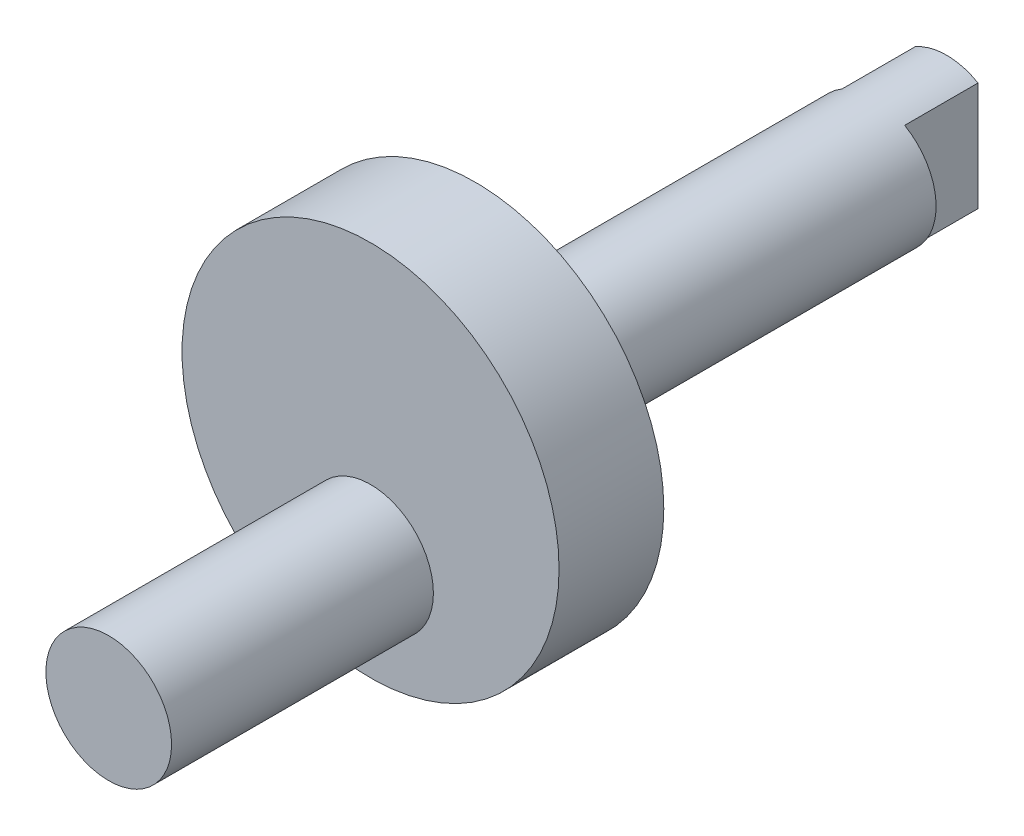
from build123d import *

# Parameters (mm, degrees)
ESBO_O1_R                = 6
RESSALTO_EXTRUS_O1_DEPTH = 45
ESBO_O2_R                = 18
RESSALTO_EXTRUS_O2_DEPTH = 10
ESBO_O3_R                = 6
RESSALTO_EXTRUS_O3_DEPTH = 25
ESBO_O4_W                = 4.529625907
ESBO_O4_H                = 11.468627296
ESBO_O4_W_2              = 6.059251814
ESBO_O4_H_2              = 15.612753126
CORTE_EXTRUS_O1_DEPTH    = 7


with BuildPart() as part:
    # Esboço1 → Ressalto-extrusão1 (new body)
    with BuildSketch(Plane.XY):
        with Locations(Location((0, 0, 0), (0, 0, 180))):
            Circle(ESBO_O1_R)
    extrude(amount=RESSALTO_EXTRUS_O1_DEPTH)

    # Esboço2 → Ressalto-extrusão2 (add)
    with BuildSketch(Plane.XY.offset(45)):
        Circle(ESBO_O2_R)
    extrude(amount=RESSALTO_EXTRUS_O2_DEPTH)

    # Esboço3 → Ressalto-extrusão3 (add)
    with BuildSketch(Plane.XY.offset(55)):
        with Locations((0, -8)):
            Circle(ESBO_O3_R)
    extrude(amount=RESSALTO_EXTRUS_O3_DEPTH)

    # Esboço4 → Corte-extrusão1 (cut)
    with BuildSketch(Plane(origin=(0, 0, 0), x_dir=(-1, 0, 0), z_dir=(0, 0, -1))):
        with Locations((-5.264812953, -0.433687587)):
            Rectangle(ESBO_O4_W, ESBO_O4_H)
        with Locations((6.029625907, -0.674625135)):
            Rectangle(ESBO_O4_W_2, ESBO_O4_H_2)
    extrude(amount=-CORTE_EXTRUS_O1_DEPTH, mode=Mode.SUBTRACT)


solid = part.part
